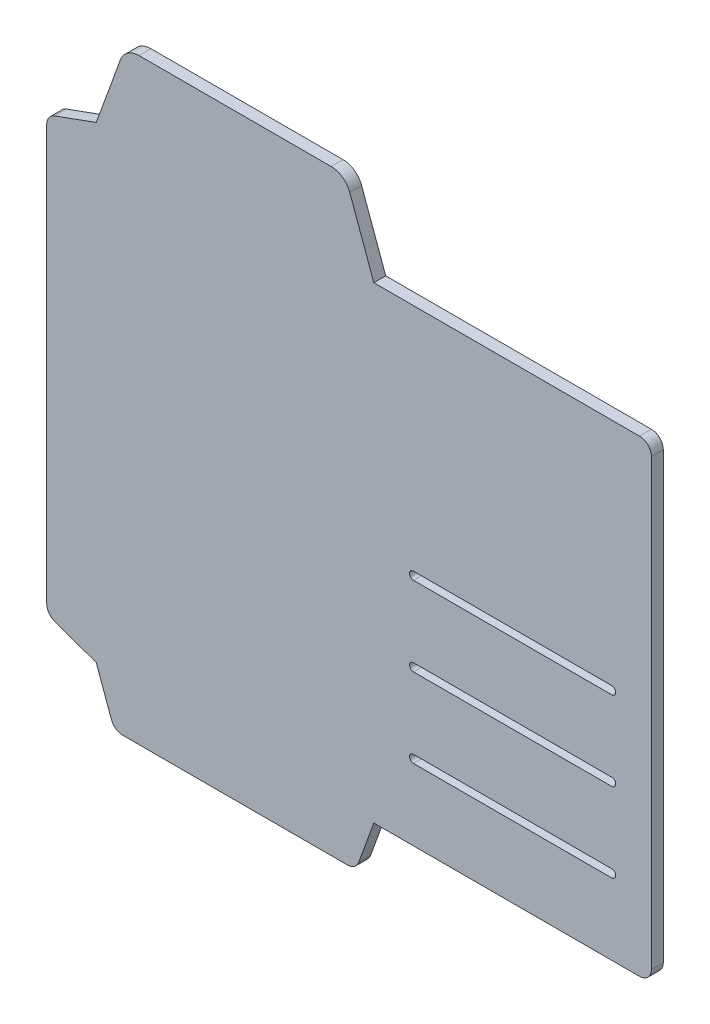
from build123d import *

# Parameters (mm, degrees)
ESQUISSE1_W                  = 70
ESQUISSE1_H                  = 118
BOSS_EXTRU_1_DEPTH           = 3
BOSS_EXTRU_2_DEPTH           = 3
CONG_1_R                     = 3
CONG_2_R                     = 3
CONG_3_R                     = 5
ESQUISSE3_W                  = 70
ESQUISSE3_H                  = 118
BOSS_EXTRU_3_DEPTH           = 3
CONG_4_R                     = 3
ENL_V_MAT_EXTRU_1_DEPTH      = 197.603662224
ENL_V_MAT_EXTRU_1_DEPTH_BACK = 197.603662224


with BuildPart() as part:
    # Esquisse1 → Boss.-Extru.1 (new body)
    with BuildSketch(Plane.XY):
        with Locations((35, 59)):
            Rectangle(ESQUISSE1_W, ESQUISSE1_H)
    extrude(amount=BOSS_EXTRU_1_DEPTH)

    # Esquisse2 → Boss.-Extru.2 (add)
    with BuildSketch(Plane.XY.offset(3)):
        Polygon((0, 118), (7.279404685, 138), (62.720595315, 138), (70, 118), align=None)
        Polygon((0, 118), (-12.5, 113.450372072), (-12.5, 4.549627928), (0, 0), align=None)
        Polygon((65.450372072, -12.5), (4.549627928, -12.5), (0, 0), (70, 0), align=None)
    extrude(amount=-BOSS_EXTRU_2_DEPTH)

    # Congé1
    cong_1_edges = [part.edges().sort_by_distance(p)[0] for p in [
        (-12.5, 4.549627928, 1.5),
        (-12.5, 113.450372072, 1.5),
    ]]
    fillet(cong_1_edges, radius=CONG_1_R)

    # Congé2
    cong_2_edges = [part.edges().sort_by_distance(p)[0] for p in [
        (65.450372072, -12.5, 1.5),
        (4.549627928, -12.5, 1.5),
    ]]
    fillet(cong_2_edges, radius=CONG_2_R)

    # Congé3
    cong_3_edges = [part.edges().sort_by_distance(p)[0] for p in [
        (7.279404685, 138, 1.5),
        (62.720595315, 138, 1.5),
    ]]
    fillet(cong_3_edges, radius=CONG_3_R)

    # Esquisse3 → Boss.-Extru.3 (add)
    with BuildSketch(Plane.XY.offset(3)):
        with Locations((105, 59)):
            Rectangle(ESQUISSE3_W, ESQUISSE3_H)
    extrude(amount=-BOSS_EXTRU_3_DEPTH)

    # Congé4
    cong_4_edges = [part.edges().sort_by_distance(p)[0] for p in [
        (140, 118, 1.5),
        (140, 0, 1.5),
    ]]
    fillet(cong_4_edges, radius=CONG_4_R)

    # Esquisse4 → Enlèv. mat.-Extru.1 (cut, two sides: drawn at the far end of the back side and taken through both)
    with BuildSketch(Plane.XY.offset(3).offset(-ENL_V_MAT_EXTRU_1_DEPTH_BACK)):
        with BuildLine():
            Line((80, 60), (130, 60))
            ThreePointArc((130, 60), (131, 59), (130, 58))
            Line((130, 58), (80, 58))
            ThreePointArc((80, 58), (79, 59), (80, 60))
        make_face()
        with BuildLine():
            Line((80, 40), (130, 40))
            ThreePointArc((130, 40), (131, 39), (130, 38))
            Line((130, 38), (80, 38))
            ThreePointArc((80, 38), (79, 39), (80, 40))
        make_face()
        with BuildLine():
            Line((80, 20), (130, 20))
            ThreePointArc((130, 20), (131, 19), (130, 18))
            Line((130, 18), (80, 18))
            ThreePointArc((80, 18), (79, 19), (80, 20))
        make_face()
    extrude(amount=ENL_V_MAT_EXTRU_1_DEPTH + ENL_V_MAT_EXTRU_1_DEPTH_BACK, mode=Mode.SUBTRACT)


solid = part.part
